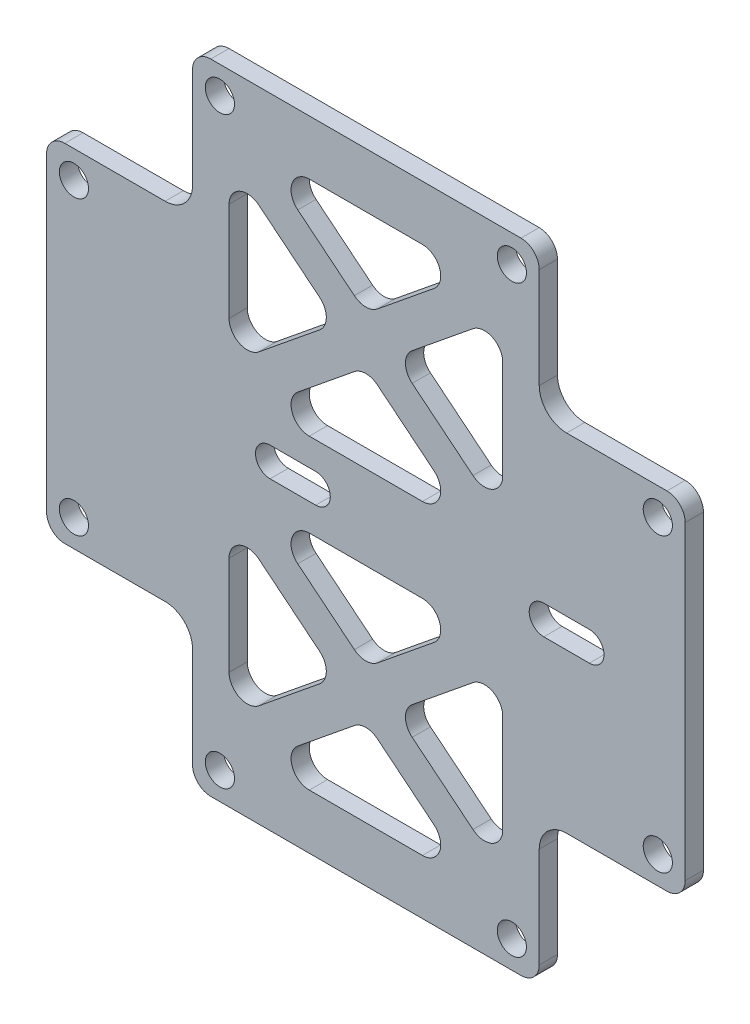
from build123d import *

# Parameters (mm, degrees)
SKETCH_1_W          = 38
SKETCH_1_H          = 70
SKETCH_1_R          = 1.6
EXTRUDE_1_DEPTH     = 2
FILLET_1_R          = 2
SKETCH_3_W          = 70
SKETCH_3_H          = 38
SKETCH_3_R          = 1.6
EXTRUDE_2_DEPTH     = 2
CUT_EXTRUDE_2_DEPTH = 2
FILLET_3_R          = 2
FILLET_4_R          = 3
CUT_EXTRUDE_3_DEPTH = 2
FILLET_5_R          = 2


with BuildPart() as part:
    # 草图1 → 凸台-拉伸1 (new body)
    with BuildSketch(Plane.XY):
        Rectangle(SKETCH_1_W, SKETCH_1_H)
        with Locations((16, 32)):
            Circle(SKETCH_1_R, mode=Mode.SUBTRACT)
        with Locations((-16, 32)):
            Circle(SKETCH_1_R, mode=Mode.SUBTRACT)
        with Locations((-16, -32)):
            Circle(SKETCH_1_R, mode=Mode.SUBTRACT)
        with Locations((16, -32)):
            Circle(SKETCH_1_R, mode=Mode.SUBTRACT)
    extrude(amount=EXTRUDE_1_DEPTH)

    # 圆角1
    fillet_1_edges = [part.edges().sort_by_distance(p)[0] for p in [
        (19, -35, 1),
        (-19, -35, 1),
        (-19, 35, 1),
        (19, 35, 1),
    ]]
    fillet(fillet_1_edges, radius=FILLET_1_R)

    # 草图3 → 凸台-拉伸2 (add)
    with BuildSketch(Plane.XY.offset(2)):
        Rectangle(SKETCH_3_W, SKETCH_3_H)
        with Locations((32, 16)):
            Circle(SKETCH_3_R, mode=Mode.SUBTRACT)
        with Locations((-32, 16)):
            Circle(SKETCH_3_R, mode=Mode.SUBTRACT)
        with Locations((-32, -16)):
            Circle(SKETCH_3_R, mode=Mode.SUBTRACT)
        with Locations((32, -16)):
            Circle(SKETCH_3_R, mode=Mode.SUBTRACT)
    extrude(amount=-EXTRUDE_2_DEPTH)

    # 草图4 → 切除-拉伸2 (cut)
    with BuildSketch(Plane.XY.offset(2)):
        with BuildLine():
            Line((-10.5, 1.6), (-5.5, 1.6))
            ThreePointArc((-5.5, 1.6), (-3.9, 0), (-5.5, -1.6))
            Line((-5.5, -1.6), (-10.5, -1.6))
            ThreePointArc((-10.5, -1.6), (-12.1, 0), (-10.5, 1.6))
        make_face()
        with BuildLine():
            Line((19.5, 1.6), (24.5, 1.6))
            ThreePointArc((24.5, 1.6), (26.1, 0), (24.5, -1.6))
            Line((24.5, -1.6), (19.5, -1.6))
            ThreePointArc((19.5, -1.6), (17.9, 0), (19.5, 1.6))
        make_face()
    extrude(amount=-CUT_EXTRUDE_2_DEPTH, mode=Mode.SUBTRACT)

    # 圆角3
    fillet_3_edges = [part.edges().sort_by_distance(p)[0] for p in [
        (35, -19, 1),
        (-35, 19, 1),
        (35, 19, 1),
        (-35, -19, 1),
    ]]
    fillet(fillet_3_edges, radius=FILLET_3_R)

    # 圆角4
    fillet_4_edges = [part.edges().sort_by_distance(p)[0] for p in [
        (-19, 19, 1),
        (-19, -19, 1),
        (19, -19, 1),
        (19, 19, 1),
    ]]
    fillet(fillet_4_edges, radius=FILLET_4_R)

    # 草图5 → 切除-拉伸3 (cut)
    with BuildSketch(Plane.XY.offset(2)):
        Polygon((0, 14.222007672), (-11.830337301, 4.6), (11.830337301, 4.6), align=None)
        Polygon((-15, 26.422007672), (-15, 7.177992328), (-3.169662699, 16.8), align=None)
        Polygon((-11.830337301, 29), (0, 19.377992328), (11.830337301, 29), align=None)
        Polygon((15, 26.422007672), (3.169662699, 16.8), (15, 7.177992328), align=None)
    cut_extrude_3 = extrude(amount=-CUT_EXTRUDE_3_DEPTH, mode=Mode.SUBTRACT)

    # 镜向1: 切除-拉伸3 across plane
    add(cut_extrude_3.mirror(Plane.ZX), mode=Mode.SUBTRACT)

    # 圆角5
    fillet_5_edges = [part.edges().sort_by_distance(p)[0] for p in [
        (-11.830337301, 29, 1),
        (11.830337301, 29, 1),
        (0, 19.377992328, 1),
        (-3.169662699, 16.8, 1),
        (-15, 7.177992328, 1),
        (-15, 26.422007672, 1),
        (15, 26.422007672, 1),
        (15, 7.177992328, 1),
        (3.169662699, 16.8, 1),
        (0, 14.222007672, 1),
        (11.830337301, 4.6, 1),
        (-11.830337301, 4.6, 1),
        (11.830337301, -29, 1),
        (-11.830337301, -29, 1),
        (0, -19.377992328, 1),
        (-15, -7.177992328, 1),
        (-3.169662699, -16.8, 1),
        (-15, -26.422007672, 1),
        (15, -7.177992328, 1),
        (15, -26.422007672, 1),
        (3.169662699, -16.8, 1),
        (11.830337301, -4.6, 1),
        (0, -14.222007672, 1),
        (-11.830337301, -4.6, 1),
    ]]
    fillet(fillet_5_edges, radius=FILLET_5_R)


solid = part.part
